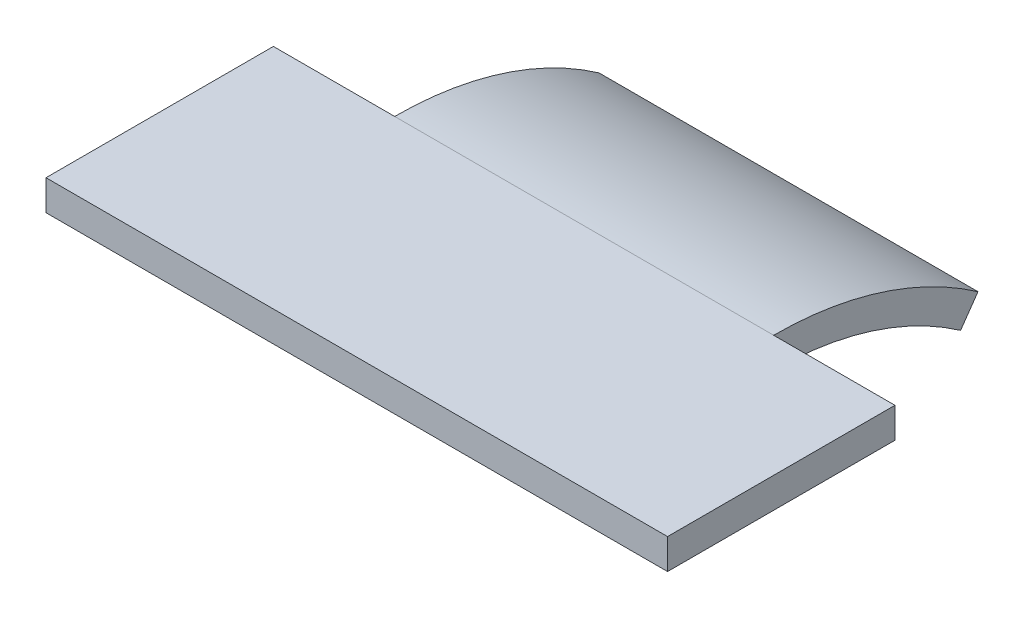
from build123d import *

# Parameters (mm, degrees)
ESTRUSIONE_ESTRUSIONE1_DEPTH = 82
SCHIZZO2_W                   = 16
SCHIZZO2_H                   = 26.958092508
TAGLIO_ESTRUSIONE1_DEPTH     = 20


with BuildPart() as part:
    # Schizzo1 → Estrusione-Estrusione1 (new body)
    with BuildSketch(Plane(origin=(0, 0, 0), x_dir=(0, 0, -1), z_dir=(1, 0, 0))):
        with BuildLine():
            Line((0, 47), (-30, 47))
            Line((-30, 47), (-30, 43))
            Line((-30, 43), (0, 43))
            ThreePointArc((0, 43), (12.930349379, 41.009828882), (24.663786763, 35.223537904))
            Line((24.663786763, 35.223537904), (26.958092508, 38.500146082))
            ThreePointArc((26.958092508, 38.500146082), (14.133172577, 44.824696685), (0, 47))
        make_face()
    extrude(amount=ESTRUSIONE_ESTRUSIONE1_DEPTH)

    # Schizzo2 → Taglio-Estrusione1 (cut)
    with BuildSketch(Plane(origin=(0, 47, 0), x_dir=(1, 0, 0), z_dir=(0, 1, 0))):
        with Locations((8, 13.479046254)):
            Rectangle(SCHIZZO2_W, SCHIZZO2_H)
        with Locations((74, 13.479046254)):
            Rectangle(SCHIZZO2_W, SCHIZZO2_H)
    extrude(amount=-TAGLIO_ESTRUSIONE1_DEPTH, mode=Mode.SUBTRACT)


solid = part.part
